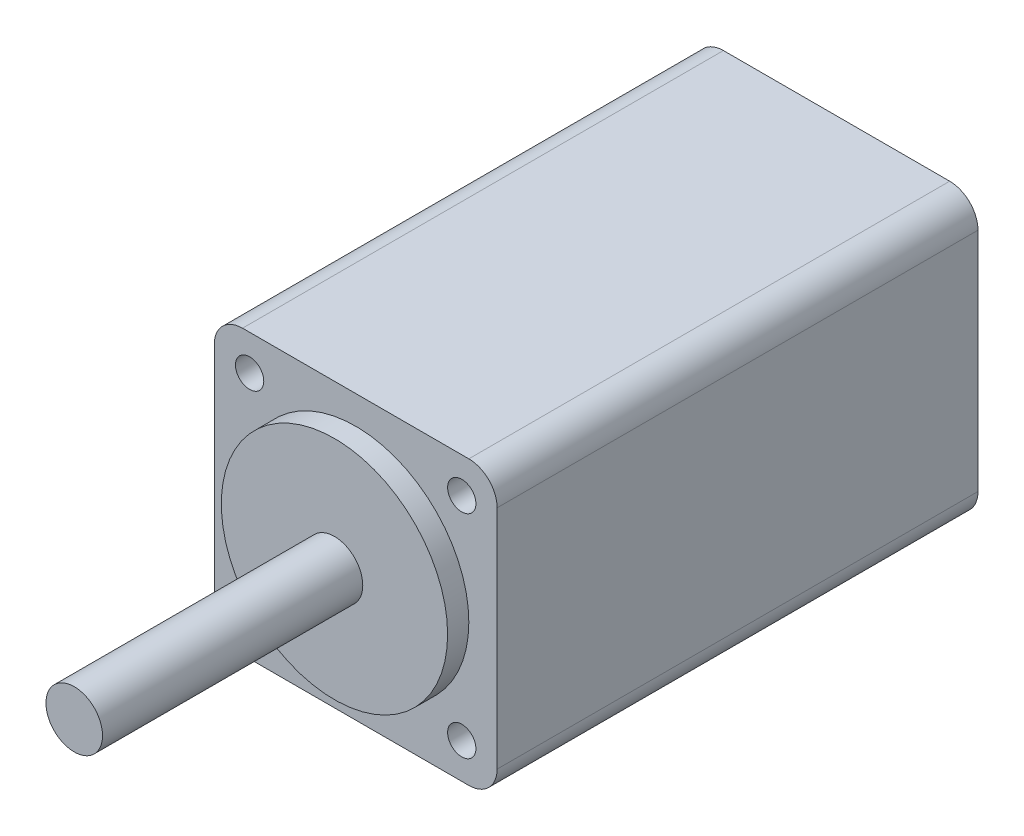
from build123d import *

# Parameters (mm, degrees)
SKETCH_1_W               = 20
SKETCH_1_H               = 20
EXTRUDE_1_DEPTH          = 34
SKETCH_2_R               = 8
EXTRUDE_2_DEPTH          = 1.5
SKETCH_3_R               = 2
EXTRUDE_3_DEPTH          = 18.4
SKETCH_4_R               = 1
CUT_EXTRUDE_1_DEPTH      = 42.263223045
MIRROR_2_COPY_1_SKETCH_R = 1
MIRROR_2_COPY_1_DEPTH    = 42.263223045
FILLET_2_R               = 2


with BuildPart() as part:
    # 草圖1 → 填料-伸長1 (new body)
    with BuildSketch(Plane.XY):
        with Locations((-11.134180278, 0)):
            Rectangle(SKETCH_1_W, SKETCH_1_H)
    extrude(amount=EXTRUDE_1_DEPTH)

    # 草圖2 → 填料-伸長2 (add)
    with BuildSketch(Plane.XY.offset(34)):
        with Locations((-11.134180278, 0)):
            Circle(SKETCH_2_R)
    extrude(amount=EXTRUDE_2_DEPTH)

    # 草圖3 → 填料-伸長3 (add)
    with BuildSketch(Plane.XY.offset(35.5)):
        with Locations((-11.134180278, 0)):
            Circle(SKETCH_3_R)
    extrude(amount=EXTRUDE_3_DEPTH)

    # 草圖4 → 除料-伸長1 (cut, through all)
    with BuildSketch(Plane.XY.offset(34)):
        with Locations((-18.634180278, 7.5)):
            Circle(SKETCH_4_R)
    cut_extrude_1 = extrude(amount=-CUT_EXTRUDE_1_DEPTH, mode=Mode.SUBTRACT)

    # 鏡射1: 除料-伸長1 across plane
    add(cut_extrude_1.mirror(Plane.ZY.offset(11.134180278)), mode=Mode.SUBTRACT)

    # 鏡射2: 除料-伸長1 across plane
    add(cut_extrude_1.mirror(Plane(origin=(0, 0, 0), x_dir=(0, 0, 1), z_dir=(0, -1, 0))), mode=Mode.SUBTRACT)

    # 鏡射2 copy 1 sketch → 鏡射2 copy 1 (cut, through all)
    with BuildSketch(Plane(origin=(-22.268360557, 0, 34), x_dir=(-1, 0, 0), z_dir=(0, 0, 1))):
        with Locations((-18.634180278, 7.5)):
            Circle(MIRROR_2_COPY_1_SKETCH_R)
    extrude(amount=-MIRROR_2_COPY_1_DEPTH, mode=Mode.SUBTRACT)

    # 圓角2
    fillet_2_edges = [part.edges().sort_by_distance(p)[0] for p in [
        (-21.134180278, 10, 17),
        (-1.134180278, 10, 17),
        (-1.134180278, -10, 17),
        (-21.134180278, -10, 17),
    ]]
    fillet(fillet_2_edges, radius=FILLET_2_R)


solid = part.part
